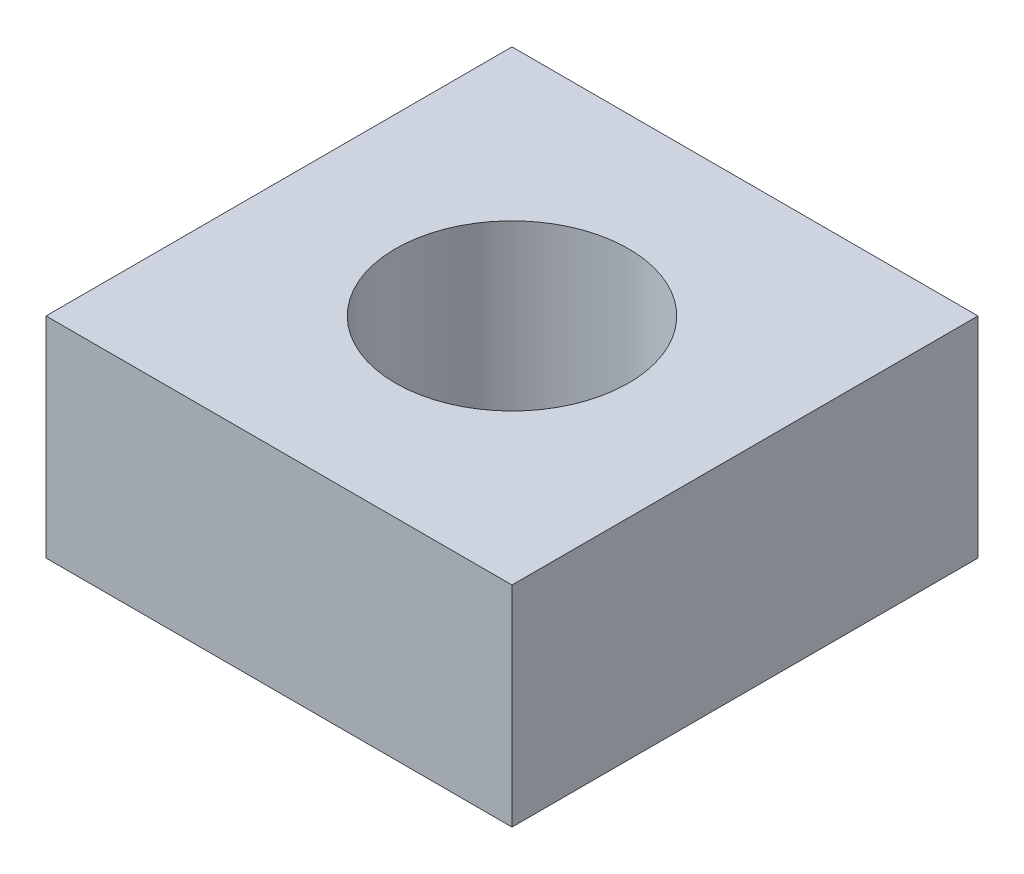
from build123d import *

# Parameters (mm, degrees)
SKETCH1_W           = 10
SKETCH1_H           = 10
SKETCH1_R           = 2.5
BOSS_EXTRUDE1_DEPTH = 4.5


with BuildPart() as part:
    # Sketch1 → Boss-Extrude1 (new body)
    with BuildSketch(Plane(origin=(0, 0, 0), x_dir=(1, 0, 0), z_dir=(0, 1, 0))):
        Rectangle(SKETCH1_W, SKETCH1_H)
        with Locations(Location((0, 0, 0), (0, 0, 270))):
            Circle(SKETCH1_R, mode=Mode.SUBTRACT)
    extrude(amount=BOSS_EXTRUDE1_DEPTH)


solid = part.part
